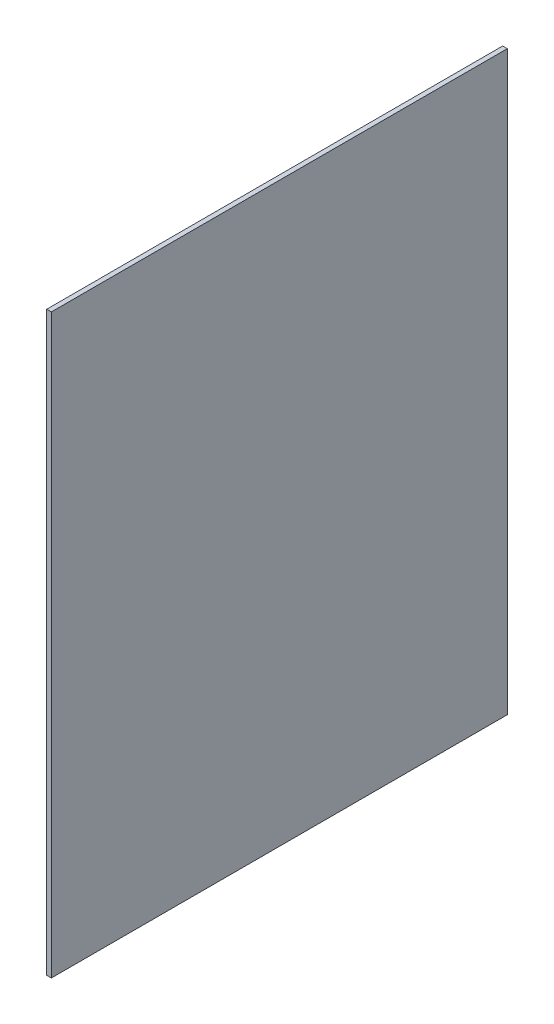
from build123d import *

# Parameters (mm, degrees)
SKETCH1_W           = 622.3
SKETCH1_H           = 787.4
BOSS_EXTRUDE1_DEPTH = 6.35


with BuildPart() as part:
    # Sketch1 → Boss-Extrude1 (new body)
    with BuildSketch(Plane(origin=(0, 0, 0), x_dir=(0, 0, -1), z_dir=(1, 0, 0))):
        with Locations((-311.15, 393.7)):
            Rectangle(SKETCH1_W, SKETCH1_H)
    extrude(amount=BOSS_EXTRUDE1_DEPTH)


solid = part.part
